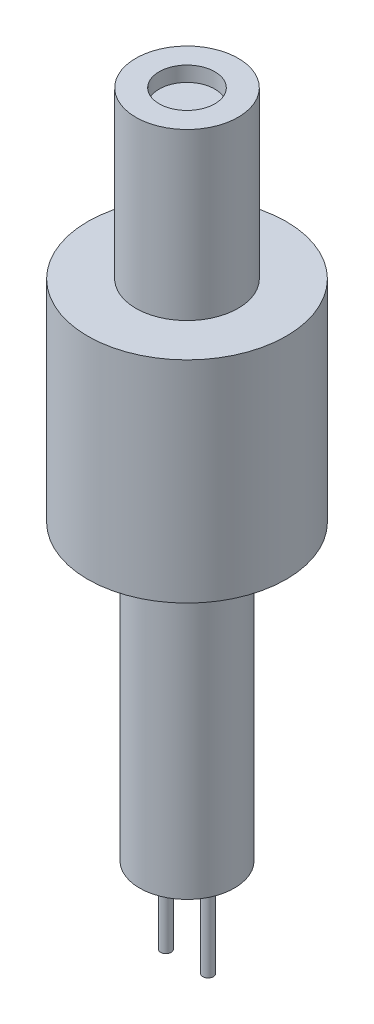
from build123d import *

# Parameters (mm, degrees)
SKETCH1_R           = 3.15
BOSS_EXTRUDE1_DEPTH = 19.5
SKETCH2_R           = 0.35
BOSS_EXTRUDE2_DEPTH = 5.8
SKETCH3_R           = 6.6
BOSS_EXTRUDE3_DEPTH = 14
SKETCH4_R           = 3.4
BOSS_EXTRUDE4_DEPTH = 11
SKETCH5_R           = 1.85
CUT_EXTRUDE1_DEPTH  = 1


with BuildPart() as part:
    # Sketch1 → Boss-Extrude1 (new body)
    with BuildSketch(Plane(origin=(0, 0, 0), x_dir=(1, 0, 0), z_dir=(0, 1, 0))):
        with Locations(Location((0, 0, 0), (0, 0, 270))):
            Circle(SKETCH1_R)
    extrude(amount=BOSS_EXTRUDE1_DEPTH)

    # Sketch2 → Boss-Extrude2 (add)
    with BuildSketch(Plane.XZ):
        with Locations(Location((-1.4, 0, 0), (0, 0, 90))):
            Circle(SKETCH2_R)
        with Locations(Location((1.4, 0, 0), (0, 0, 90))):
            Circle(SKETCH2_R)
    extrude(amount=BOSS_EXTRUDE2_DEPTH)

    # Sketch3 → Boss-Extrude3 (add)
    with BuildSketch(Plane(origin=(0, 19.5, 0), x_dir=(1, 0, 0), z_dir=(0, 1, 0))):
        with Locations(Location((0, 0, 0), (0, 0, 270))):
            Circle(SKETCH3_R)
    extrude(amount=BOSS_EXTRUDE3_DEPTH)

    # Sketch4 → Boss-Extrude4 (add)
    with BuildSketch(Plane(origin=(0, 33.5, 0), x_dir=(1, 0, 0), z_dir=(0, 1, 0))):
        with Locations(Location((0, 0, 0), (0, 0, 270))):
            Circle(SKETCH4_R)
    extrude(amount=BOSS_EXTRUDE4_DEPTH)

    # Sketch5 → Cut-Extrude1 (cut)
    with BuildSketch(Plane(origin=(0, 44.5, 0), x_dir=(1, 0, 0), z_dir=(0, 1, 0))):
        with Locations(Location((0, 0, 0), (0, 0, 270))):
            Circle(SKETCH5_R)
    extrude(amount=-CUT_EXTRUDE1_DEPTH, mode=Mode.SUBTRACT)


solid = part.part
